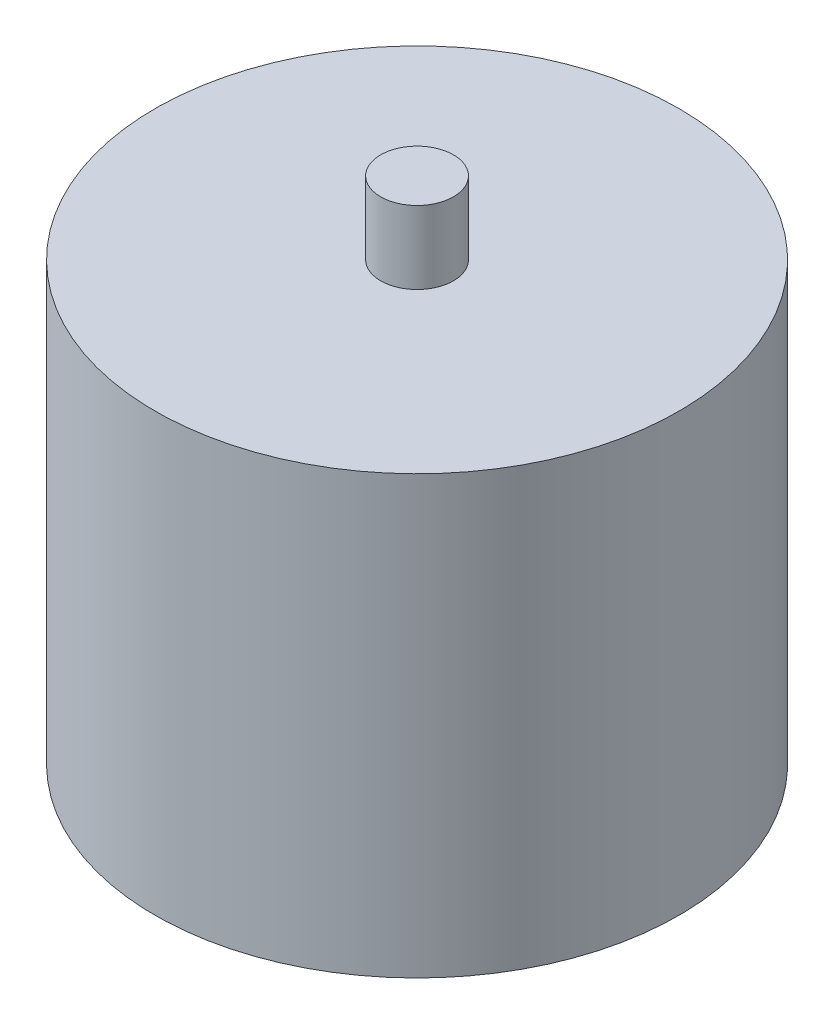
from build123d import *

# Parameters (mm, degrees)
SKETCH1_R           = 11.43
BOSS_EXTRUDE1_DEPTH = 19.05
SKETCH2_R           = 1.5875
BOSS_EXTRUDE2_DEPTH = 3.175


with BuildPart() as part:
    # Sketch1 → Boss-Extrude1 (new body)
    with BuildSketch(Plane(origin=(0, 0, 0), x_dir=(1, 0, 0), z_dir=(0, 1, 0))):
        with Locations(Location((0, 0, 0), (0, 0, 90))):
            Circle(SKETCH1_R)
    extrude(amount=BOSS_EXTRUDE1_DEPTH)

    # Sketch2 → Boss-Extrude2 (add)
    with BuildSketch(Plane(origin=(0, 19.05, 0), x_dir=(1, 0, 0), z_dir=(0, 1, 0))):
        with Locations(Location((0, 0, 0), (0, 0, 270))):
            Circle(SKETCH2_R)
    extrude(amount=BOSS_EXTRUDE2_DEPTH)


solid = part.part
